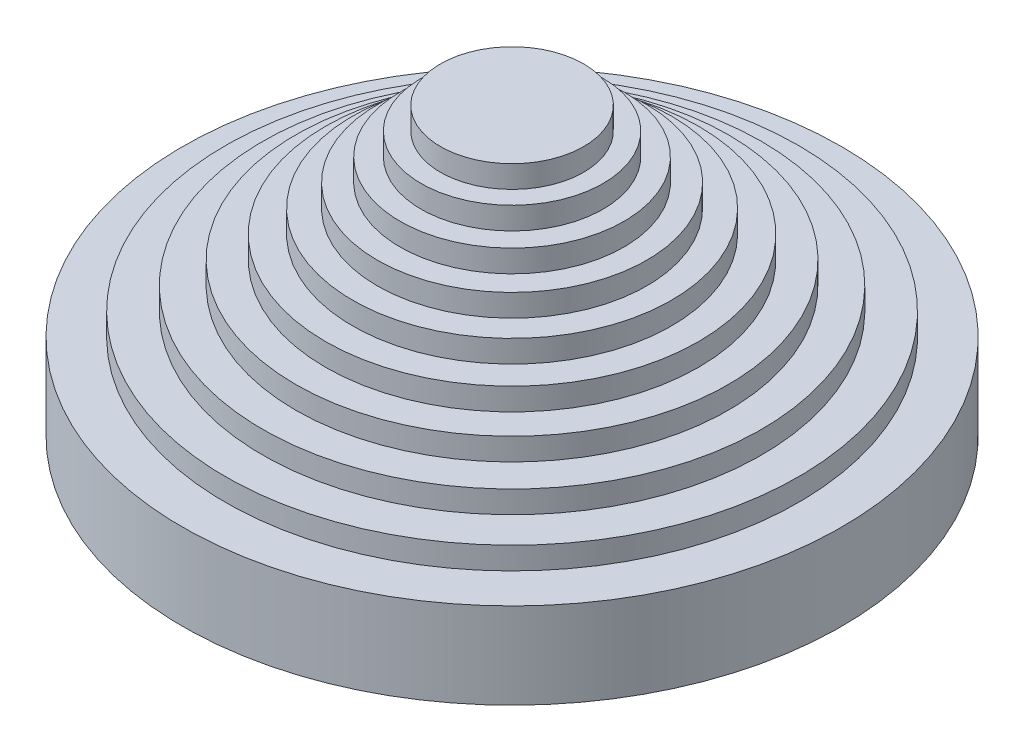
from build123d import *

# Parameters (mm, degrees)
SKETCH2_R               = 3.2
BOSS_EXTRUDE1_DEPTH     = 2.6
CUT_EXTRUDE1_DEPTH      = 3
CUT_EXTRUDE1_DEPTH_BACK = 3


with BuildPart() as part:
    # Sketch1 → Revolve1 (revolve)
    with BuildSketch(Plane(origin=(0, 0, 0), x_dir=(0, 0, -1), z_dir=(1, 0, 0))):
        Polygon((-11.5, 0), (-11.5, 3), (-10.00428681, 3), (-10.00428681, 3.777777778), (-8.703281017, 3.777777778), (-8.703281017, 4.555555556), (-7.548361646, 4.555555556), (-7.548361646, 5.333333333), (-6.509180682, 5.333333333), (-6.509180682, 6.111111111), (-5.565268632, 6.111111111), (-5.565268632, 6.888888889), (-4.702037743, 6.888888889), (-4.702037743, 7.666666667), (-3.908655746, 7.666666667), (-3.908655746, 8.444444444), (-3.176819128, 8.444444444), (-3.176819128, 9.222222222), (-2.5, 9.222222222), (-2.5, 10), (0, 10), (0, 0), align=None)
    revolve(axis=Axis((0, 0, 0), (0, 1, 0)))

    # Sketch2 → Boss-Extrude1 (add)
    with BuildSketch(Plane.XZ):
        Circle(SKETCH2_R)
    extrude(amount=BOSS_EXTRUDE1_DEPTH)

    # Sketch2<3> → Cut-Extrude1 (cut, two sides: drawn at the far end of the back side and taken through both)
    with BuildSketch(Plane.XZ.offset(-CUT_EXTRUDE1_DEPTH_BACK)):
        with BuildLine():
            Line((-1.449137675, 1.45), (1.449137675, 1.45))
            ThreePointArc((1.449137675, 1.45), (0, -2.05), (-1.449137675, 1.45))
        make_face()
    extrude(amount=CUT_EXTRUDE1_DEPTH + CUT_EXTRUDE1_DEPTH_BACK, mode=Mode.SUBTRACT)


solid = part.part
